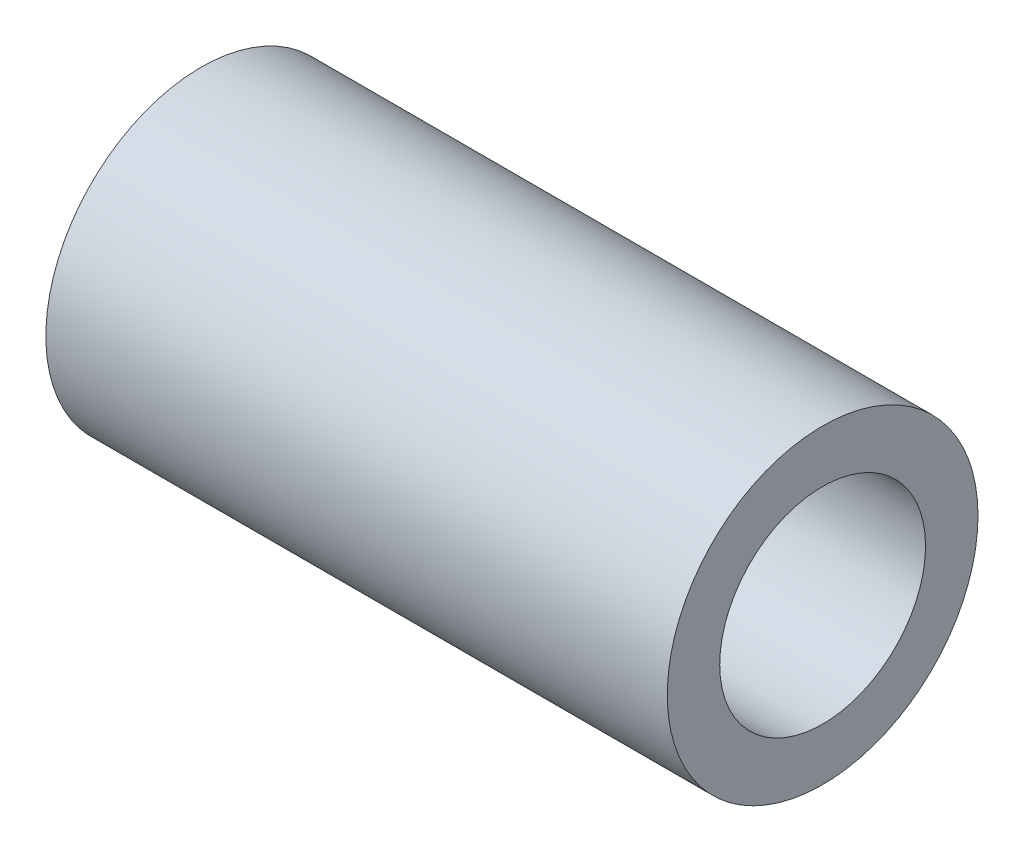
from build123d import *

# Parameters (mm, degrees)
SKETCH_1_R      = 4
SKETCH_1_R_2    = 2.65
EXTRUDE_1_DEPTH = 16


with BuildPart() as part:
    # 草图1 → 凸台-拉伸1 (new body)
    with BuildSketch(Plane(origin=(0, 0, 0), x_dir=(0, 0, -1), z_dir=(1, 0, 0))):
        Circle(SKETCH_1_R)
        Circle(SKETCH_1_R_2, mode=Mode.SUBTRACT)
    extrude(amount=EXTRUDE_1_DEPTH)


solid = part.part
